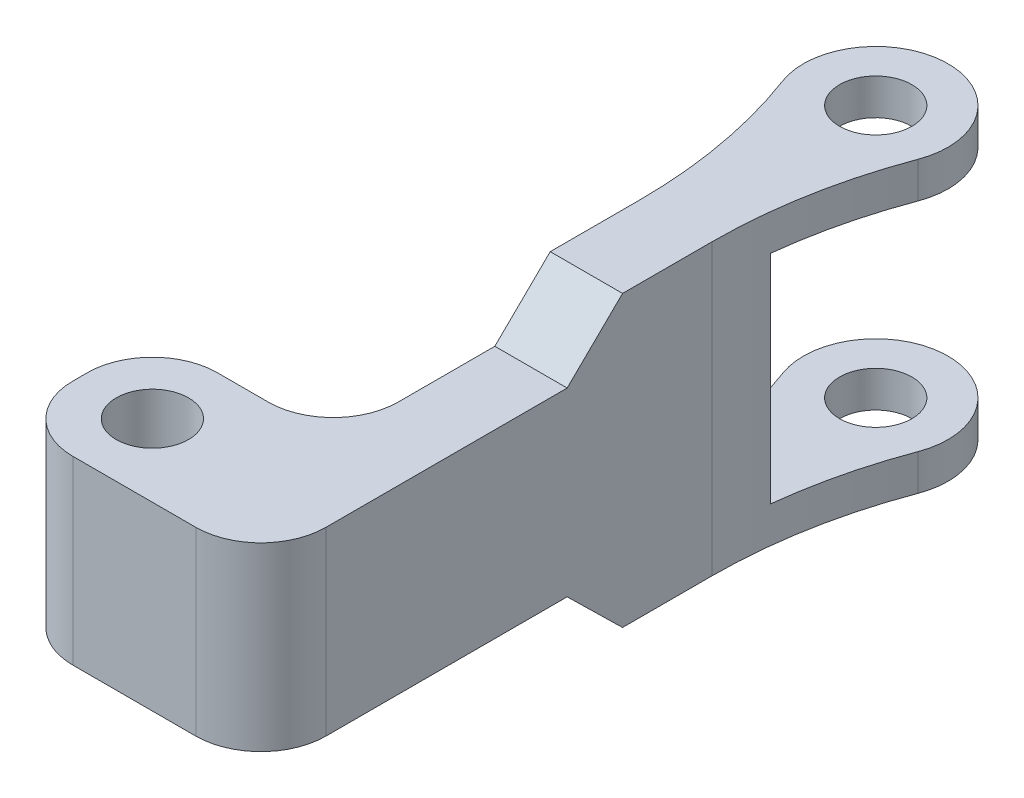
from build123d import *

# Parameters (mm, degrees)
SKETCH1_R               = 2.5
BOSS_EXTRUDE1_DEPTH     = 25
CUT_EXTRUDE2_DEPTH      = 54.619026474
CUT_EXTRUDE2_DEPTH_BACK = 54.619026474
SKETCH4_W               = 15
SKETCH4_H               = 15


with BuildPart() as part:
    # Sketch1 → Boss-Extrude1 (new body)
    with BuildSketch(Plane(origin=(0, 0, 0), x_dir=(1, 0, 0), z_dir=(0, 1, 0))):
        with BuildLine():
            Line((7.5, 9.5), (7.5, 26.170683314))
            ThreePointArc((7.5, 26.170683314), (6.949725489, 32.307957892), (5.316455696, 38.249453584))
            ThreePointArc((5.316455696, 38.249453584), (10, 45), (14.683544304, 38.249453584))
            ThreePointArc((14.683544304, 38.249453584), (13.050274511, 32.307957892), (12.5, 26.170683314))
            Line((12.5, 26.170683314), (12.5, 15))
            Line((12.5, 15), (12.5, -0.5))
            ThreePointArc((12.5, -0.5), (11.181980515, -3.681980515), (8, -5))
            Line((8, -5), (-0.5, -5))
            ThreePointArc((-0.5, -5), (-3.681980515, -3.681980515), (-5, -0.5))
            Line((-5, -0.5), (-5, 0.5))
            ThreePointArc((-5, 0.5), (-3.681980515, 3.681980515), (-0.5, 5))
            Line((-0.5, 5), (3, 5))
            ThreePointArc((3, 5), (6.181980515, 6.318019485), (7.5, 9.5))
        make_face()
        with Locations(Location((0, 0, 0), (0, 0, 270))):
            Circle(SKETCH1_R, mode=Mode.SUBTRACT)
        with Locations(Location((10, 40, 0), (0, 0, 270))):
            Circle(SKETCH1_R, mode=Mode.SUBTRACT)
    extrude(amount=BOSS_EXTRUDE1_DEPTH)

    # Sketch4 → Cut-Extrude2 (cut, two sides: drawn at the far end of the back side and taken through both)
    with BuildSketch(Plane(origin=(0, 0, 0), x_dir=(0, 0, -1), z_dir=(1, 0, 0)).offset(-CUT_EXTRUDE2_DEPTH_BACK)):
        with Locations((37.501037615, 12.5)):
            Rectangle(SKETCH4_W, SKETCH4_H)
        Polygon((45, 25), (45, 22.5), (20, 22.5), (16.170683314, 18.75), (-5, 18.75), (-5, 25), align=None)
        Polygon((45, 0), (-5, 0), (-5, 6.25), (16.170683314, 6.25), (20, 2.5), (45, 2.5), align=None)
    extrude(amount=CUT_EXTRUDE2_DEPTH + CUT_EXTRUDE2_DEPTH_BACK, mode=Mode.SUBTRACT)


solid = part.part
